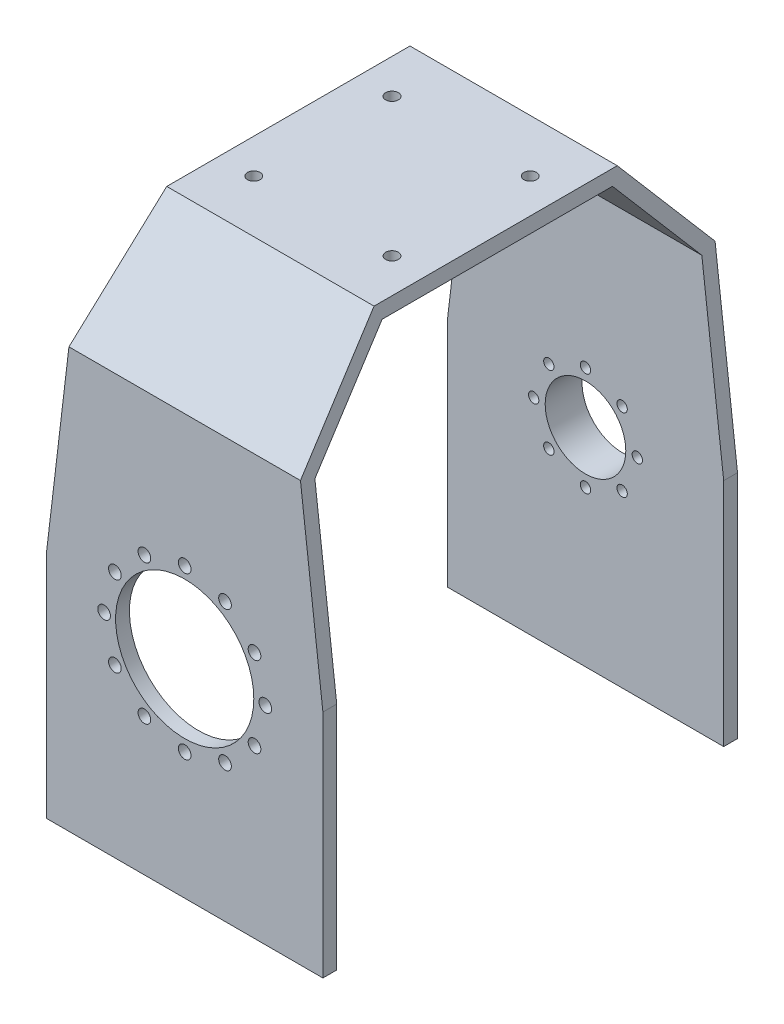
from build123d import *

# Parameters (mm, degrees)
EXTRUDE_1_DEPTH          = 180
CUT_EXTRUDE_1_DEPTH      = 304.003530042
CUT_EXTRUDE_1_DEPTH_BACK = 304.003530042
SKETCH_14_R              = 30
SKETCH_14_R_2            = 2.75
CUT_EXTRUDE_3_DEPTH      = 50
SKETCH_15_R              = 27.5
EXTRUDE_3_DEPTH          = 10
SKETCH_16_R              = 17.5
SKETCH_16_R_2            = 2.25
CUT_EXTRUDE_4_DEPTH      = 32.5
SKETCH_17_R              = 2.75
CUT_EXTRUDE_5_DEPTH      = 6


with BuildPart() as part:
    # 草图11 → 拉伸-薄壁1 (new body)
    with BuildSketch(Plane(origin=(0, 0, 0), x_dir=(0, 0, -1), z_dir=(1, 0, 0))):
        Polygon((-84, 0), (-84, 180), (-50, 220.519622148), (50, 220.519622148), (84, 180), (84, 0), (90, 0), (90, 182.183821406), (52.797845949, 226.519622148), (-52.797845949, 226.519622148), (-90, 182.183821406), (-90, 0), align=None)
    extrude(amount=EXTRUDE_1_DEPTH)

    # 草图12 → 切除-拉伸1 (cut, two sides: drawn at the far end of the back side and taken through both)
    with BuildSketch(Plane.XY.offset(-CUT_EXTRUDE_1_DEPTH_BACK)):
        Polygon((0, 0), (0, 226.519622148), (45, 226.519622148), (30, 100), (30, 0), align=None)
        Polygon((150, 0), (180, 0), (180, 226.519622148), (135, 226.519622148), (150, 100), align=None)
    extrude(amount=CUT_EXTRUDE_1_DEPTH + CUT_EXTRUDE_1_DEPTH_BACK, mode=Mode.SUBTRACT)

    # 草图14 → 切除-拉伸3 (cut)
    with BuildSketch(Plane.XY.offset(90)):
        with Locations((90, 90)):
            Circle(SKETCH_14_R)
        with Locations((90, 125)):
            Circle(SKETCH_14_R_2)
        with Locations((107.5, 120.310889132)):
            Circle(SKETCH_14_R_2)
        with Locations((120.310889132, 107.5)):
            Circle(SKETCH_14_R_2)
        with Locations((125, 90)):
            Circle(SKETCH_14_R_2)
        with Locations((120.310889132, 72.5)):
            Circle(SKETCH_14_R_2)
        with Locations((107.5, 59.689110868)):
            Circle(SKETCH_14_R_2)
        with Locations((90, 55)):
            Circle(SKETCH_14_R_2)
        with Locations((72.5, 59.689110868)):
            Circle(SKETCH_14_R_2)
        with Locations((59.689110868, 72.5)):
            Circle(SKETCH_14_R_2)
        with Locations((55, 90)):
            Circle(SKETCH_14_R_2)
        with Locations((59.689110868, 107.5)):
            Circle(SKETCH_14_R_2)
        with Locations((72.5, 120.310889132)):
            Circle(SKETCH_14_R_2)
    extrude(amount=-CUT_EXTRUDE_3_DEPTH, mode=Mode.SUBTRACT)

    # 草图15 → 凸台-拉伸3 (add)
    with BuildSketch(Plane(origin=(0, 0, -90), x_dir=(-1, 0, 0), z_dir=(0, 0, -1))):
        with Locations(Location((-90, 90, 0), (0, 0, 270))):
            Circle(SKETCH_15_R)
    extrude(amount=EXTRUDE_3_DEPTH)

    # 草图16 → 切除-拉伸4 (cut)
    with BuildSketch(Plane(origin=(0, 0, -100), x_dir=(-1, 0, 0), z_dir=(0, 0, -1))):
        with Locations(Location((-90, 90, 0), (0, 0, 90))):
            Circle(SKETCH_16_R)
        with Locations(Location((-67.5, 90, 0), (0, 0, 90))):
            Circle(SKETCH_16_R_2)
        with Locations(Location((-74.090097423, 74.090097423, 0), (0, 0, 90))):
            Circle(SKETCH_16_R_2)
        with Locations(Location((-90, 67.5, 0), (0, 0, 90))):
            Circle(SKETCH_16_R_2)
        with Locations(Location((-105.909902577, 74.090097423, 0), (0, 0, 90))):
            Circle(SKETCH_16_R_2)
        with Locations(Location((-112.5, 90, 0), (0, 0, 90))):
            Circle(SKETCH_16_R_2)
        with Locations(Location((-105.909902577, 105.909902577, 0), (0, 0, 90))):
            Circle(SKETCH_16_R_2)
        with Locations(Location((-90, 112.5, 0), (0, 0, 90))):
            Circle(SKETCH_16_R_2)
        with Locations(Location((-74.090097423, 105.909902577, 0), (0, 0, 90))):
            Circle(SKETCH_16_R_2)
    extrude(amount=-CUT_EXTRUDE_4_DEPTH, mode=Mode.SUBTRACT)

    # 草图17 → 切除-拉伸5 (cut)
    with BuildSketch(Plane(origin=(0, 226.519622148, 0), x_dir=(1, 0, 0), z_dir=(0, 1, 0))):
        with Locations(Location((120, 30, 0), (0, 0, 270))):
            Circle(SKETCH_17_R)
        with Locations(Location((120, -30, 0), (0, 0, 90))):
            Circle(SKETCH_17_R)
        with Locations(Location((60, -30, 0), (0, 0, 270))):
            Circle(SKETCH_17_R)
        with Locations(Location((60, 30, 0), (0, 0, 90))):
            Circle(SKETCH_17_R)
    extrude(amount=-CUT_EXTRUDE_5_DEPTH, mode=Mode.SUBTRACT)


solid = part.part
